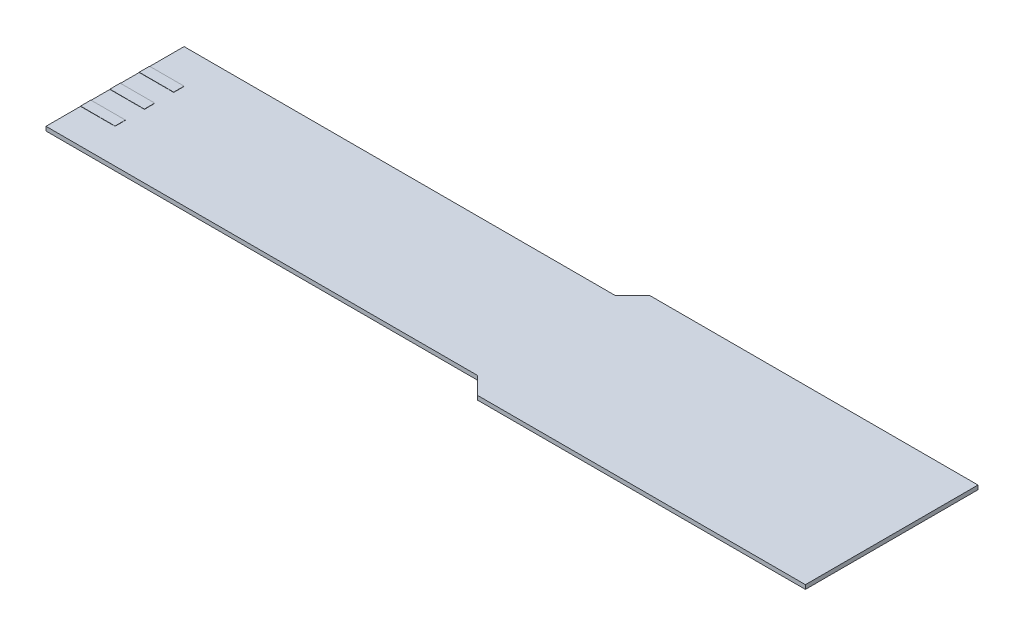
from build123d import *

# Parameters (mm, degrees)
BOSS_EXTRUDE1_START   = -0.6
SKETCH1_W             = 62.5
SKETCH1_H             = 20
SKETCH1_W_2           = 47.5
SKETCH1_H_2           = 25
BOSS_EXTRUDE1_DEPTH   = 0.6
BOSS_EXTRUDE2_START   = 0.035
SKETCH2_W             = 5
SKETCH2_H             = 1.5
BOSS_EXTRUDE2_DEPTH   = 0.3
BOSS_EXTRUDE2_2_DEPTH = 0.3
BOSS_EXTRUDE2_3_DEPTH = 0.3


with BuildPart() as part:
    # Sketch1 → Boss-Extrude1 (new body)
    with BuildSketch(Plane(origin=(0, 0, 0), x_dir=(1, 0, 0), z_dir=(0, 1, 0)).offset(BOSS_EXTRUDE1_START)):
        with Locations((31.25, 0)):
            Rectangle(SKETCH1_W, SKETCH1_H)
        Polygon((65, 12.5), (65, -12.5), (62.5, -10), (62.5, 10), align=None)
        with Locations((88.75, 0)):
            Rectangle(SKETCH1_W_2, SKETCH1_H_2)
    extrude(amount=BOSS_EXTRUDE1_DEPTH)


with BuildPart() as body_2:
    # Sketch2 → Boss-Extrude2 (new body)
    with BuildSketch(Plane(origin=(0, 0, 0), x_dir=(1, 0, 0), z_dir=(0, 1, 0)).offset(BOSS_EXTRUDE2_START)):
        with Locations((2.5, 0)):
            Rectangle(SKETCH2_W, SKETCH2_H)
    extrude(amount=-BOSS_EXTRUDE2_DEPTH)


with BuildPart() as body_3:
    # Sketch2 → Boss-Extrude2 2 (new body)
    with BuildSketch(Plane(origin=(0, 0, 0), x_dir=(1, 0, 0), z_dir=(0, 1, 0)).offset(BOSS_EXTRUDE2_START)):
        with Locations((2.5, 4.25)):
            Rectangle(SKETCH2_W, SKETCH2_H)
    extrude(amount=-BOSS_EXTRUDE2_2_DEPTH)


with BuildPart() as body_4:
    # Sketch2 → Boss-Extrude2 3 (new body)
    with BuildSketch(Plane(origin=(0, 0, 0), x_dir=(1, 0, 0), z_dir=(0, 1, 0)).offset(BOSS_EXTRUDE2_START)):
        with Locations((2.5, -4.25)):
            Rectangle(SKETCH2_W, SKETCH2_H)
    extrude(amount=-BOSS_EXTRUDE2_3_DEPTH)


solid = Compound([part.part, body_2.part, body_3.part, body_4.part])
